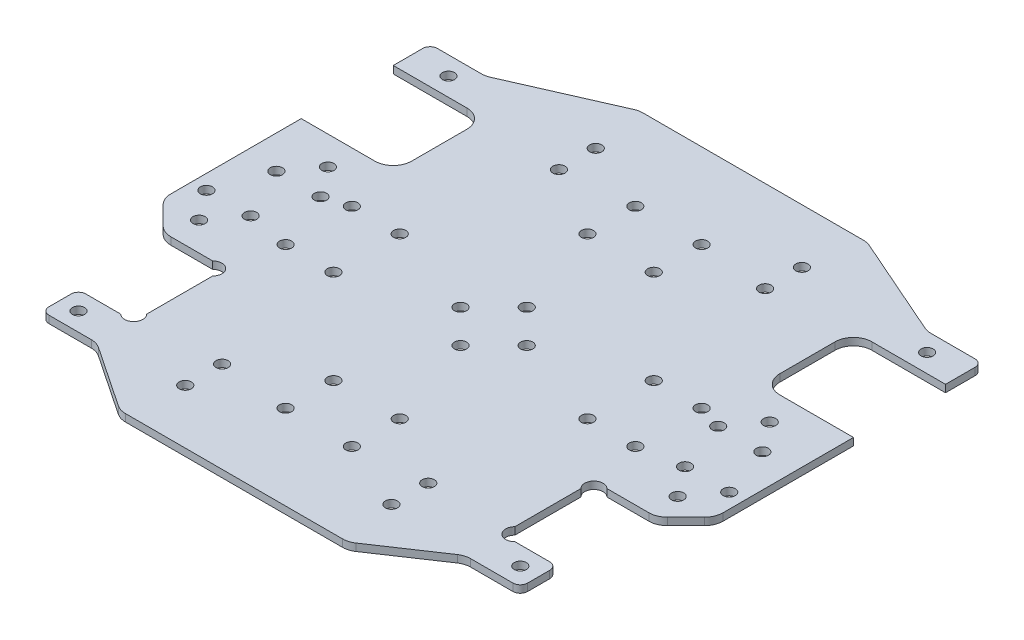
from build123d import *

# Parameters (mm, degrees)
SKETCH_1_W                         = 150
SKETCH_1_H                         = 141
EXTRUDE_1_DEPTH                    = 2
CUT_EXTRUDE_1_REACH                = 104.953
SKETCH_2_R                         = 1.65
CUT_EXTRUDE_5_REACH                = 104.953
SKETCH_9_W                         = 25
SKETCH_9_H                         = 47.75
CUT_EXTRUDE_6_REACH                = 104.953
CHAMFER_1_SIZE                     = 8
CUT_EXTRUDE_7_REACH                = 104.953
SKETCH_11_W                        = 25
SKETCH_11_H                        = 25
CUT_EXTRUDE_8_REACH                = 104.953
SKETCH_12_R                        = 1.65
FILLET_1_R                         = 5
CUT_EXTRUDE_9_REACH                = 104.953
SKETCH_14_W                        = 15
SKETCH_14_H                        = 10
EXTRUDE_2_DEPTH                    = 2
CUT_EXTRUDE_10_REACH               = 104.953
SKETCH_15_R                        = 1.65
CUT_EXTRUDE_START                  = -2
SKETCH_18_R                        = 2.5
CUT_EXTRUDE_13_DEPTH               = 2
CUT_EXTRUDE_14_REACH               = 104.953
SKETCH_19_R                        = 1.65
CUT_EXTRUDE_15_REACH               = 104.953
SKETCH_20_R                        = 1.65
FILLET_2_R                         = 2
CUT_EXTRUDE_12_REACH               = 104.953
SKETCH_17_R                        = 1.65
FILLET_3_R                         = 5
PATTERN_CIRCULAR_1_COUNT           = 2
PATTERN_CIRCULAR_1_ANGLE           = 90
PATTERN_CIRCULAR_1_COPY_1_REACH    = 104.953
PATTERN_CIRCULAR_1_COPY_1_SKETCH_R = 1.65


with BuildPart() as part:
    # 草图1 → 凸台-拉伸1 (new body)
    with BuildSketch(Plane(origin=(0, 0, 0), x_dir=(1, 0, 0), z_dir=(0, 1, 0))):
        Rectangle(SKETCH_1_W, SKETCH_1_H)
    extrude(amount=EXTRUDE_1_DEPTH)

    # 草图2 → 切除-拉伸1 (cut, up to next)
    with BuildSketch(Plane(origin=(0, 2, 0), x_dir=(1, 0, 0), z_dir=(0, 1, 0)), mode=Mode.PRIVATE) as cut_extrude_1_sk1:
        with Locations(Location((-60, 15, 0), (0, 0, 270))):
            Circle(SKETCH_2_R)
    cut_extrude_1_tool1 = extrude(cut_extrude_1_sk1.sketch, amount=-CUT_EXTRUDE_1_REACH, mode=Mode.PRIVATE) & part.part
    # 草图2 → 切除-拉伸1 (cut, up to next)
    with BuildSketch(Plane(origin=(0, 2, 0), x_dir=(1, 0, 0), z_dir=(0, 1, 0)), mode=Mode.PRIVATE) as cut_extrude_1_sk2:
        with Locations(Location((-66, 7, 0), (0, 0, 270))):
            Circle(SKETCH_2_R)
    cut_extrude_1_tool2 = extrude(cut_extrude_1_sk2.sketch, amount=-CUT_EXTRUDE_1_REACH, mode=Mode.PRIVATE) & part.part
    # 草图2 → 切除-拉伸1 (cut, up to next)
    with BuildSketch(Plane(origin=(0, 2, 0), x_dir=(1, 0, 0), z_dir=(0, 1, 0)), mode=Mode.PRIVATE) as cut_extrude_1_sk3:
        with Locations(Location((-54, 7, 0), (0, 0, 270))):
            Circle(SKETCH_2_R)
    cut_extrude_1_tool3 = extrude(cut_extrude_1_sk3.sketch, amount=-CUT_EXTRUDE_1_REACH, mode=Mode.PRIVATE) & part.part
    # 草图2 → 切除-拉伸1 (cut, up to next)
    with BuildSketch(Plane(origin=(0, 2, 0), x_dir=(1, 0, 0), z_dir=(0, 1, 0)), mode=Mode.PRIVATE) as cut_extrude_1_sk4:
        with Locations(Location((-71, -7, 0), (0, 0, 270))):
            Circle(SKETCH_2_R)
    cut_extrude_1_tool4 = extrude(cut_extrude_1_sk4.sketch, amount=-CUT_EXTRUDE_1_REACH, mode=Mode.PRIVATE) & part.part
    # 草图2 → 切除-拉伸1 (cut, up to next)
    with BuildSketch(Plane(origin=(0, 2, 0), x_dir=(1, 0, 0), z_dir=(0, 1, 0)), mode=Mode.PRIVATE) as cut_extrude_1_sk5:
        with Locations(Location((-59, -7, 0), (0, 0, 270))):
            Circle(SKETCH_2_R)
    cut_extrude_1_tool5 = extrude(cut_extrude_1_sk5.sketch, amount=-CUT_EXTRUDE_1_REACH, mode=Mode.PRIVATE) & part.part
    # 草图2 → 切除-拉伸1 (cut, up to next)
    with BuildSketch(Plane(origin=(0, 2, 0), x_dir=(1, 0, 0), z_dir=(0, 1, 0)), mode=Mode.PRIVATE) as cut_extrude_1_sk6:
        with Locations(Location((-65, -15, 0), (0, 0, 270))):
            Circle(SKETCH_2_R)
    cut_extrude_1_tool6 = extrude(cut_extrude_1_sk6.sketch, amount=-CUT_EXTRUDE_1_REACH, mode=Mode.PRIVATE) & part.part
    cut_extrude_1_1 = cut_extrude_1_tool1.solids().sort_by_distance((-60, 2, -15))[0]
    add(cut_extrude_1_1, mode=Mode.SUBTRACT)
    cut_extrude_1_2 = cut_extrude_1_tool2.solids().sort_by_distance((-66, 2, -7))[0]
    add(cut_extrude_1_2, mode=Mode.SUBTRACT)
    cut_extrude_1_3 = cut_extrude_1_tool3.solids().sort_by_distance((-54, 2, -7))[0]
    add(cut_extrude_1_3, mode=Mode.SUBTRACT)
    cut_extrude_1_4 = cut_extrude_1_tool4.solids().sort_by_distance((-71, 2, 7))[0]
    add(cut_extrude_1_4, mode=Mode.SUBTRACT)
    cut_extrude_1_5 = cut_extrude_1_tool5.solids().sort_by_distance((-59, 2, 7))[0]
    add(cut_extrude_1_5, mode=Mode.SUBTRACT)
    cut_extrude_1_6 = cut_extrude_1_tool6.solids().sort_by_distance((-65, 2, 15))[0]
    add(cut_extrude_1_6, mode=Mode.SUBTRACT)
    cut_extrude_1 = cut_extrude_1_1 + cut_extrude_1_2 + cut_extrude_1_3 + cut_extrude_1_4 + cut_extrude_1_5 + cut_extrude_1_6  # 切除-拉伸1 as one shape, for the pattern or mirror that repeats it

    # 草图9 → 切除-拉伸5 (cut, up to next)
    with BuildSketch(Plane(origin=(0, 2, 0), x_dir=(1, 0, 0), z_dir=(0, 1, 0)), mode=Mode.PRIVATE) as cut_extrude_5_sk1:
        with Locations((-62.5, -46.625)):
            Rectangle(SKETCH_9_W, SKETCH_9_H)
    cut_extrude_5_tool1 = extrude(cut_extrude_5_sk1.sketch, amount=-CUT_EXTRUDE_5_REACH, mode=Mode.PRIVATE) & part.part
    # 草图9 → 切除-拉伸5 (cut, up to next)
    with BuildSketch(Plane(origin=(0, 2, 0), x_dir=(1, 0, 0), z_dir=(0, 1, 0)), mode=Mode.PRIVATE) as cut_extrude_5_sk2:
        with Locations((62.5, -46.625)):
            Rectangle(SKETCH_9_W, SKETCH_9_H)
    cut_extrude_5_tool2 = extrude(cut_extrude_5_sk2.sketch, amount=-CUT_EXTRUDE_5_REACH, mode=Mode.PRIVATE) & part.part
    add(cut_extrude_5_tool1.solids().sort_by_distance((-62.5, 2, 46.625))[0], mode=Mode.SUBTRACT)
    add(cut_extrude_5_tool2.solids().sort_by_distance((62.5, 2, 46.625))[0], mode=Mode.SUBTRACT)

    # 草图10 → 切除-拉伸6 (cut, up to next)
    with BuildSketch(Plane(origin=(0, 2, 0), x_dir=(1, 0, 0), z_dir=(0, 1, 0)), mode=Mode.PRIVATE) as cut_extrude_6_sk1:
        Polygon((-75, 70.5), (-31, 70.5), (-60, 57.75), (-75, 57.75), align=None)
    cut_extrude_6_tool1 = extrude(cut_extrude_6_sk1.sketch, amount=-CUT_EXTRUDE_6_REACH, mode=Mode.PRIVATE) & part.part
    cut_extrude_6 = cut_extrude_6_tool1.solids().sort_by_distance((-59.062147, 2, -65.169492))[0]
    add(cut_extrude_6, mode=Mode.SUBTRACT)

    # 镜向1: 切除-拉伸1, 切除-拉伸6 across plane
    add(cut_extrude_1.mirror(Plane(origin=(0, 0, 0), x_dir=(0, 0, 1), z_dir=(1, 0, 0))), mode=Mode.SUBTRACT)
    add(cut_extrude_6.mirror(Plane(origin=(0, 0, 0), x_dir=(0, 0, 1), z_dir=(1, 0, 0))), mode=Mode.SUBTRACT)

    # 倒角1
    chamfer_1_edges = [part.edges().sort_by_distance(p)[0] for p in [
        (-75, 1, 22.75),
        (75, 1, 22.75),
    ]]
    chamfer(chamfer_1_edges, length=CHAMFER_1_SIZE)

    # 草图11 → 切除-拉伸7 (cut, up to next)
    with BuildSketch(Plane(origin=(0, 2, 0), x_dir=(1, 0, 0), z_dir=(0, 1, 0)), mode=Mode.PRIVATE) as cut_extrude_7_sk1:
        with Locations((-62.5, 35.25)):
            Rectangle(SKETCH_11_W, SKETCH_11_H)
    cut_extrude_7_tool1 = extrude(cut_extrude_7_sk1.sketch, amount=-CUT_EXTRUDE_7_REACH, mode=Mode.PRIVATE) & part.part
    # 草图11 → 切除-拉伸7 (cut, up to next)
    with BuildSketch(Plane(origin=(0, 2, 0), x_dir=(1, 0, 0), z_dir=(0, 1, 0)), mode=Mode.PRIVATE) as cut_extrude_7_sk2:
        with Locations((62.5, 35.25)):
            Rectangle(SKETCH_11_W, SKETCH_11_H)
    cut_extrude_7_tool2 = extrude(cut_extrude_7_sk2.sketch, amount=-CUT_EXTRUDE_7_REACH, mode=Mode.PRIVATE) & part.part
    add(cut_extrude_7_tool1.solids().sort_by_distance((-62.5, 2, -35.25))[0], mode=Mode.SUBTRACT)
    add(cut_extrude_7_tool2.solids().sort_by_distance((62.5, 2, -35.25))[0], mode=Mode.SUBTRACT)

    # 草图12 → 切除-拉伸8 (cut, up to next)
    with BuildSketch(Plane(origin=(0, 2, 0), x_dir=(1, 0, 0), z_dir=(0, 1, 0)), mode=Mode.PRIVATE) as cut_extrude_8_sk1:
        with Locations(Location((-65, 52.75, 0), (0, 0, 270))):
            Circle(SKETCH_12_R)
    cut_extrude_8_tool1 = extrude(cut_extrude_8_sk1.sketch, amount=-CUT_EXTRUDE_8_REACH, mode=Mode.PRIVATE) & part.part
    # 草图12 → 切除-拉伸8 (cut, up to next)
    with BuildSketch(Plane(origin=(0, 2, 0), x_dir=(1, 0, 0), z_dir=(0, 1, 0)), mode=Mode.PRIVATE) as cut_extrude_8_sk2:
        with Locations(Location((65, 52.75, 0), (0, 0, 90))):
            Circle(SKETCH_12_R)
    cut_extrude_8_tool2 = extrude(cut_extrude_8_sk2.sketch, amount=-CUT_EXTRUDE_8_REACH, mode=Mode.PRIVATE) & part.part
    add(cut_extrude_8_tool1.solids().sort_by_distance((-65, 2, -52.75))[0], mode=Mode.SUBTRACT)
    add(cut_extrude_8_tool2.solids().sort_by_distance((65, 2, -52.75))[0], mode=Mode.SUBTRACT)

    # 圆角1
    fillet_1_edges = [part.edges().sort_by_distance(p)[0] for p in [
        (67, 1, 22.75),
        (75, 1, 14.75),
        (-75, 1, 14.75),
        (-67, 1, 22.75),
        (-50, 1, -47.75),
        (-50, 1, -22.75),
        (50, 1, -22.75),
        (50, 1, -47.75),
    ]]
    fillet(fillet_1_edges, radius=FILLET_1_R)

    # 草图13 → 切除-拉伸9 (cut, up to next)
    with BuildSketch(Plane(origin=(0, 2, 0), x_dir=(1, 0, 0), z_dir=(0, 1, 0)), mode=Mode.PRIVATE) as cut_extrude_9_sk1:
        Polygon((-50, -70.5), (-50, -57.75), (-31, -70.5), align=None)
    cut_extrude_9_tool1 = extrude(cut_extrude_9_sk1.sketch, amount=-CUT_EXTRUDE_9_REACH, mode=Mode.PRIVATE) & part.part
    cut_extrude_9 = cut_extrude_9_tool1.solids().sort_by_distance((-43.666667, 2, 66.25))[0]
    add(cut_extrude_9, mode=Mode.SUBTRACT)

    # 草图14 → 凸台-拉伸2 (add)
    with BuildSketch(Plane(origin=(0, 0, 0), x_dir=(1, 0, 0), z_dir=(0, 1, 0))):
        with Locations((-57.5, -52.75)):
            Rectangle(SKETCH_14_W, SKETCH_14_H)
    extrude_2 = extrude(amount=EXTRUDE_2_DEPTH)

    # 草图15 → 切除-拉伸10 (cut, up to next)
    with BuildSketch(Plane(origin=(0, 2, 0), x_dir=(1, 0, 0), z_dir=(0, 1, 0)), mode=Mode.PRIVATE) as cut_extrude_10_sk1:
        with Locations(Location((-60, -52.75, 0), (0, 0, 270))):
            Circle(SKETCH_15_R)
    cut_extrude_10_tool1 = extrude(cut_extrude_10_sk1.sketch, amount=-CUT_EXTRUDE_10_REACH, mode=Mode.PRIVATE) & part.part
    cut_extrude_10 = cut_extrude_10_tool1.solids().sort_by_distance((-60, 2, 52.75))[0]
    add(cut_extrude_10, mode=Mode.SUBTRACT)

    # 草图18 → 切除-拉伸13 (cut)
    with BuildSketch(Plane(origin=(0, 2, 0), x_dir=(1, 0, 0), z_dir=(0, 1, 0)).offset(CUT_EXTRUDE_START)):
        with Locations((-51.767766953, -24.517766953)):
            Circle(SKETCH_18_R)
        with Locations((-51.767766953, -45.982233047)):
            Circle(SKETCH_18_R)
    cut_extrude_13 = extrude(amount=CUT_EXTRUDE_13_DEPTH, mode=Mode.SUBTRACT)

    # 草图19 → 切除-拉伸14 (cut, up to next)
    with BuildSketch(Plane(origin=(0, 2, 0), x_dir=(1, 0, 0), z_dir=(0, 1, 0)), mode=Mode.PRIVATE) as cut_extrude_14_sk1:
        with Locations(Location((-47.5, 9, 0), (0, 0, 270))):
            Circle(SKETCH_19_R)
    cut_extrude_14_tool1 = extrude(cut_extrude_14_sk1.sketch, amount=-CUT_EXTRUDE_14_REACH, mode=Mode.PRIVATE) & part.part
    # 草图19 → 切除-拉伸14 (cut, up to next)
    with BuildSketch(Plane(origin=(0, 2, 0), x_dir=(1, 0, 0), z_dir=(0, 1, 0)), mode=Mode.PRIVATE) as cut_extrude_14_sk2:
        with Locations(Location((-47.5, -9, 0), (0, 0, 270))):
            Circle(SKETCH_19_R)
    cut_extrude_14_tool2 = extrude(cut_extrude_14_sk2.sketch, amount=-CUT_EXTRUDE_14_REACH, mode=Mode.PRIVATE) & part.part
    # 草图19 → 切除-拉伸14 (cut, up to next)
    with BuildSketch(Plane(origin=(0, 2, 0), x_dir=(1, 0, 0), z_dir=(0, 1, 0)), mode=Mode.PRIVATE) as cut_extrude_14_sk3:
        with Locations(Location((-34.5, -9, 0), (0, 0, 270))):
            Circle(SKETCH_19_R)
    cut_extrude_14_tool3 = extrude(cut_extrude_14_sk3.sketch, amount=-CUT_EXTRUDE_14_REACH, mode=Mode.PRIVATE) & part.part
    # 草图19 → 切除-拉伸14 (cut, up to next)
    with BuildSketch(Plane(origin=(0, 2, 0), x_dir=(1, 0, 0), z_dir=(0, 1, 0)), mode=Mode.PRIVATE) as cut_extrude_14_sk4:
        with Locations(Location((-34.5, 9, 0), (0, 0, 270))):
            Circle(SKETCH_19_R)
    cut_extrude_14_tool4 = extrude(cut_extrude_14_sk4.sketch, amount=-CUT_EXTRUDE_14_REACH, mode=Mode.PRIVATE) & part.part
    cut_extrude_14_1 = cut_extrude_14_tool1.solids().sort_by_distance((-47.5, 2, -9))[0]
    add(cut_extrude_14_1, mode=Mode.SUBTRACT)
    cut_extrude_14_2 = cut_extrude_14_tool2.solids().sort_by_distance((-47.5, 2, 9))[0]
    add(cut_extrude_14_2, mode=Mode.SUBTRACT)
    cut_extrude_14_3 = cut_extrude_14_tool3.solids().sort_by_distance((-34.5, 2, 9))[0]
    add(cut_extrude_14_3, mode=Mode.SUBTRACT)
    cut_extrude_14_4 = cut_extrude_14_tool4.solids().sort_by_distance((-34.5, 2, -9))[0]
    add(cut_extrude_14_4, mode=Mode.SUBTRACT)
    cut_extrude_14 = cut_extrude_14_1 + cut_extrude_14_2 + cut_extrude_14_3 + cut_extrude_14_4  # 切除-拉伸14 as one shape, for the pattern or mirror that repeats it

    # 镜向2: 切除-拉伸9, 凸台-拉伸2, 切除-拉伸10, 切除-拉伸13 across plane
    add(cut_extrude_9.mirror(Plane(origin=(0, 0, 0), x_dir=(0, 0, 1), z_dir=(1, 0, 0))), mode=Mode.SUBTRACT)
    add(extrude_2.mirror(Plane(origin=(0, 0, 0), x_dir=(0, 0, 1), z_dir=(1, 0, 0))))
    add(cut_extrude_10.mirror(Plane(origin=(0, 0, 0), x_dir=(0, 0, 1), z_dir=(1, 0, 0))), mode=Mode.SUBTRACT)
    add(cut_extrude_13.mirror(Plane(origin=(0, 0, 0), x_dir=(0, 0, 1), z_dir=(1, 0, 0))), mode=Mode.SUBTRACT)

    # 镜向4: 切除-拉伸14 across plane
    add(cut_extrude_14.mirror(Plane(origin=(0, 0, 0), x_dir=(0, 0, 1), z_dir=(1, 0, 0))), mode=Mode.SUBTRACT)

    # 草图20 → 切除-拉伸15 (cut, up to next)
    with BuildSketch(Plane(origin=(0, 2, 0), x_dir=(1, 0, 0), z_dir=(0, 1, 0)), mode=Mode.PRIVATE) as cut_extrude_15_sk1:
        with Locations(Location((0, 9, 0), (0, 0, 270))):
            Circle(SKETCH_20_R)
    cut_extrude_15_tool1 = extrude(cut_extrude_15_sk1.sketch, amount=-CUT_EXTRUDE_15_REACH, mode=Mode.PRIVATE) & part.part
    # 草图20 → 切除-拉伸15 (cut, up to next)
    with BuildSketch(Plane(origin=(0, 2, 0), x_dir=(1, 0, 0), z_dir=(0, 1, 0)), mode=Mode.PRIVATE) as cut_extrude_15_sk2:
        with Locations(Location((0, -9, 0), (0, 0, 270))):
            Circle(SKETCH_20_R)
    cut_extrude_15_tool2 = extrude(cut_extrude_15_sk2.sketch, amount=-CUT_EXTRUDE_15_REACH, mode=Mode.PRIVATE) & part.part
    cut_extrude_15_1 = cut_extrude_15_tool1.solids().sort_by_distance((0, 2, -9))[0]
    add(cut_extrude_15_1, mode=Mode.SUBTRACT)
    cut_extrude_15_2 = cut_extrude_15_tool2.solids().sort_by_distance((0, 2, 9))[0]
    add(cut_extrude_15_2, mode=Mode.SUBTRACT)
    cut_extrude_15 = cut_extrude_15_1 + cut_extrude_15_2  # 切除-拉伸15 as one shape, for the pattern or mirror that repeats it

    # 圆角2
    fillet_2_edges = [part.edges().sort_by_distance(p)[0] for p in [
        (75, 1, -57.75),
        (-65, 1, 57.75),
        (-65, 1, 47.75),
        (65, 1, 57.75),
        (65, 1, 47.75),
        (-75, 1, -57.75),
    ]]
    fillet(fillet_2_edges, radius=FILLET_2_R)

    # 草图17 → 切除-拉伸12 (cut, up to next)
    with BuildSketch(Plane(origin=(0, 2, 0), x_dir=(1, 0, 0), z_dir=(0, 1, 0)), mode=Mode.PRIVATE) as cut_extrude_12_sk1:
        with Locations(Location((-28, -45.75, 0), (0, 0, 270))):
            Circle(SKETCH_17_R)
    cut_extrude_12_tool1 = extrude(cut_extrude_12_sk1.sketch, amount=-CUT_EXTRUDE_12_REACH, mode=Mode.PRIVATE) & part.part
    # 草图17 → 切除-拉伸12 (cut, up to next)
    with BuildSketch(Plane(origin=(0, 2, 0), x_dir=(1, 0, 0), z_dir=(0, 1, 0)), mode=Mode.PRIVATE) as cut_extrude_12_sk2:
        with Locations(Location((-28, -55.75, 0), (0, 0, 270))):
            Circle(SKETCH_17_R)
    cut_extrude_12_tool2 = extrude(cut_extrude_12_sk2.sketch, amount=-CUT_EXTRUDE_12_REACH, mode=Mode.PRIVATE) & part.part
    # 草图17 → 切除-拉伸12 (cut, up to next)
    with BuildSketch(Plane(origin=(0, 2, 0), x_dir=(1, 0, 0), z_dir=(0, 1, 0)), mode=Mode.PRIVATE) as cut_extrude_12_sk3:
        with Locations(Location((28, -45.75, 0), (0, 0, 270))):
            Circle(SKETCH_17_R)
    cut_extrude_12_tool3 = extrude(cut_extrude_12_sk3.sketch, amount=-CUT_EXTRUDE_12_REACH, mode=Mode.PRIVATE) & part.part
    # 草图17 → 切除-拉伸12 (cut, up to next)
    with BuildSketch(Plane(origin=(0, 2, 0), x_dir=(1, 0, 0), z_dir=(0, 1, 0)), mode=Mode.PRIVATE) as cut_extrude_12_sk4:
        with Locations(Location((28, -55.75, 0), (0, 0, 270))):
            Circle(SKETCH_17_R)
    cut_extrude_12_tool4 = extrude(cut_extrude_12_sk4.sketch, amount=-CUT_EXTRUDE_12_REACH, mode=Mode.PRIVATE) & part.part
    cut_extrude_12_1 = cut_extrude_12_tool1.solids().sort_by_distance((-28, 2, 45.75))[0]
    add(cut_extrude_12_1, mode=Mode.SUBTRACT)
    cut_extrude_12_2 = cut_extrude_12_tool2.solids().sort_by_distance((-28, 2, 55.75))[0]
    add(cut_extrude_12_2, mode=Mode.SUBTRACT)
    cut_extrude_12_3 = cut_extrude_12_tool3.solids().sort_by_distance((28, 2, 45.75))[0]
    add(cut_extrude_12_3, mode=Mode.SUBTRACT)
    cut_extrude_12_4 = cut_extrude_12_tool4.solids().sort_by_distance((28, 2, 55.75))[0]
    add(cut_extrude_12_4, mode=Mode.SUBTRACT)
    cut_extrude_12 = cut_extrude_12_1 + cut_extrude_12_2 + cut_extrude_12_3 + cut_extrude_12_4  # 切除-拉伸12 as one shape, for the pattern or mirror that repeats it

    # 镜向3: 切除-拉伸12 across plane
    add(cut_extrude_12.mirror(Plane.XY), mode=Mode.SUBTRACT)

    # 圆角3
    fillet_3_edges = [part.edges().sort_by_distance(p)[0] for p in [
        (60, 1, -57.75),
        (31, 1, -70.5),
        (-31, 1, 70.5),
        (-50, 1, 57.75),
        (31, 1, 70.5),
        (50, 1, 57.75),
        (-31, 1, -70.5),
        (-60, 1, -57.75),
    ]]
    fillet(fillet_3_edges, radius=FILLET_3_R)

    # 阵列(圆周)1: 切除-拉伸14, 切除-拉伸15 ×2 about axis
    pattern_circular_1_axis = Axis((0, 0, 0), (0, -1, 0))
    add([cut_extrude_14.rotate(pattern_circular_1_axis, i * PATTERN_CIRCULAR_1_ANGLE / (PATTERN_CIRCULAR_1_COUNT - 1)) for i in range(1, PATTERN_CIRCULAR_1_COUNT)], mode=Mode.SUBTRACT)
    add([cut_extrude_15.rotate(pattern_circular_1_axis, i * PATTERN_CIRCULAR_1_ANGLE / (PATTERN_CIRCULAR_1_COUNT - 1)) for i in range(1, PATTERN_CIRCULAR_1_COUNT)], mode=Mode.SUBTRACT)

    # 阵列(圆周)1 copy 1 sketch → 阵列(圆周)1 copy 1 (cut, up to next)
    with BuildSketch(Plane(origin=(0, 2, 0), x_dir=(0, 0, -1), z_dir=(0, 1, 0)), mode=Mode.PRIVATE) as pattern_circular_1_copy_1_sk1:
        with Locations((-47.5, -9)):
            Circle(PATTERN_CIRCULAR_1_COPY_1_SKETCH_R)
    pattern_circular_1_copy_1_tool1 = extrude(pattern_circular_1_copy_1_sk1.sketch, amount=-PATTERN_CIRCULAR_1_COPY_1_REACH, mode=Mode.PRIVATE) & part.part
    # 阵列(圆周)1 copy 1 sketch → 阵列(圆周)1 copy 1 (cut, up to next)
    with BuildSketch(Plane(origin=(0, 2, 0), x_dir=(0, 0, -1), z_dir=(0, 1, 0)), mode=Mode.PRIVATE) as pattern_circular_1_copy_1_sk2:
        with Locations((-47.5, 9)):
            Circle(PATTERN_CIRCULAR_1_COPY_1_SKETCH_R)
    pattern_circular_1_copy_1_tool2 = extrude(pattern_circular_1_copy_1_sk2.sketch, amount=-PATTERN_CIRCULAR_1_COPY_1_REACH, mode=Mode.PRIVATE) & part.part
    # 阵列(圆周)1 copy 1 sketch → 阵列(圆周)1 copy 1 (cut, up to next)
    with BuildSketch(Plane(origin=(0, 2, 0), x_dir=(0, 0, -1), z_dir=(0, 1, 0)), mode=Mode.PRIVATE) as pattern_circular_1_copy_1_sk3:
        with Locations((-34.5, 9)):
            Circle(PATTERN_CIRCULAR_1_COPY_1_SKETCH_R)
    pattern_circular_1_copy_1_tool3 = extrude(pattern_circular_1_copy_1_sk3.sketch, amount=-PATTERN_CIRCULAR_1_COPY_1_REACH, mode=Mode.PRIVATE) & part.part
    # 阵列(圆周)1 copy 1 sketch → 阵列(圆周)1 copy 1 (cut, up to next)
    with BuildSketch(Plane(origin=(0, 2, 0), x_dir=(0, 0, -1), z_dir=(0, 1, 0)), mode=Mode.PRIVATE) as pattern_circular_1_copy_1_sk4:
        with Locations((-34.5, -9)):
            Circle(PATTERN_CIRCULAR_1_COPY_1_SKETCH_R)
    pattern_circular_1_copy_1_tool4 = extrude(pattern_circular_1_copy_1_sk4.sketch, amount=-PATTERN_CIRCULAR_1_COPY_1_REACH, mode=Mode.PRIVATE) & part.part
    add(pattern_circular_1_copy_1_tool1.solids().sort_by_distance((9, 2, 47.5))[0], mode=Mode.SUBTRACT)
    add(pattern_circular_1_copy_1_tool2.solids().sort_by_distance((-9, 2, 47.5))[0], mode=Mode.SUBTRACT)
    add(pattern_circular_1_copy_1_tool3.solids().sort_by_distance((-9, 2, 34.5))[0], mode=Mode.SUBTRACT)
    add(pattern_circular_1_copy_1_tool4.solids().sort_by_distance((9, 2, 34.5))[0], mode=Mode.SUBTRACT)


solid = part.part
